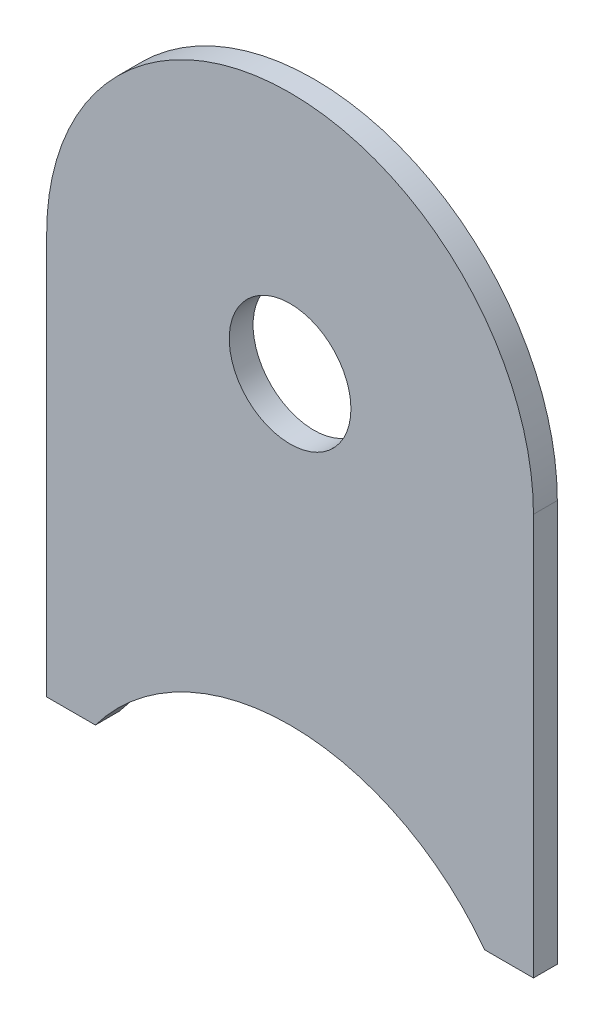
from build123d import *

# Parameters (mm, degrees)
SKETCH1_R           = 3.175
BOSS_EXTRUDE1_DEPTH = 1.2446


with BuildPart() as part:
    # Sketch1 → Boss-Extrude1 (new body)
    with BuildSketch(Plane.XY):
        with BuildLine():
            Line((0, 0), (2.54, 0))
            ThreePointArc((2.54, 0), (12.7, 5.08), (22.86, 0))
            Line((22.86, 0), (25.4, 0))
            Line((25.4, 0), (25.4, 20.955))
            ThreePointArc((25.4, 20.955), (12.7, 33.655), (0, 20.955))
            Line((0, 20.955), (0, 0))
        make_face()
        with Locations((12.7, 20.955)):
            Circle(SKETCH1_R, mode=Mode.SUBTRACT)
    extrude(amount=BOSS_EXTRUDE1_DEPTH)


solid = part.part
